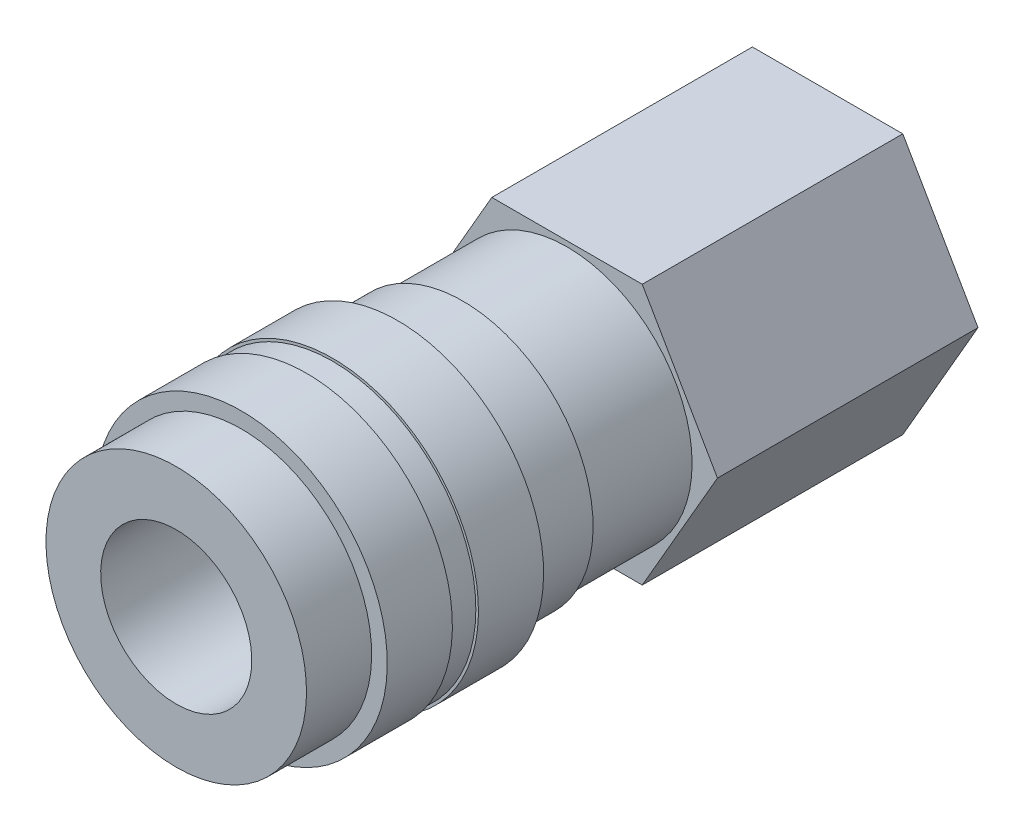
from build123d import *

# Parameters (mm, degrees)
SKETCH2_R                         = 31.732831761
CUT_EXTRUDE1_DEPTH                = 32.254845925
PIPE_TAP_DRILL_FOR_1_8_TAP1_D     = 8.4328
PIPE_TAP_DRILL_FOR_1_8_TAP1_DEPTH = 6.35
PIPE_TAP_DRILL_FOR_1_8_TAP1_TIP   = 2.533468714


with BuildPart() as part:
    # Sketch1 → Revolve1 (revolve)
    with BuildSketch(Plane(origin=(0, 0, 0), x_dir=(0, 0, -1), z_dir=(1, 0, 0)), mode=Mode.PRIVATE) as revolve1_sk:
        Polygon((3.175, 6.35), (3.175, 7.112), (6.35, 7.112), (6.35, 6.985), (7.62, 6.985), (7.62, 7.112), (10.795, 7.112), (10.795, 6.35), (13.97, 6.35), (13.97, 6.096), (19.05, 6.096), (19.05, 17.520886019), (31.75, 17.520886019), (31.75, 0), (12.7, 0), (12.7, 3.683), (0, 3.683), (0, 6.35), align=None)
    revolve(revolve1_sk.sketch.rotate(Axis((0, 0, -12.7), (0, 0, -1)), 180), axis=Axis((0, 0, -12.7), (0, 0, -1)))

    # Sketch2 → Cut-Extrude1 (cut, through all)
    with BuildSketch(Plane(origin=(0, 0, -19.05), x_dir=(-1, 0, 0), z_dir=(0, 0, -1))):
        Circle(SKETCH2_R)
        Polygon((7.332348419, 0), (3.666174209, 6.35), (-3.666174209, 6.35), (-7.332348419, 0), (-3.666174209, -6.35), (3.666174209, -6.35), align=None, mode=Mode.SUBTRACT)
    extrude(amount=CUT_EXTRUDE1_DEPTH, mode=Mode.SUBTRACT)

    # Pipe Tap Drill for 1/8 Tap1
    with Locations(Plane(origin=(0, 0, -31.75), x_dir=(-1, 0, 0), z_dir=(0, 0, -1))):
        with Locations((0, 0)):
            Hole(PIPE_TAP_DRILL_FOR_1_8_TAP1_D / 2, depth=PIPE_TAP_DRILL_FOR_1_8_TAP1_DEPTH)
            with Locations((0, 0, -(PIPE_TAP_DRILL_FOR_1_8_TAP1_DEPTH + PIPE_TAP_DRILL_FOR_1_8_TAP1_TIP / 2))):  # 118° drill point
                Cone(0, PIPE_TAP_DRILL_FOR_1_8_TAP1_D / 2, PIPE_TAP_DRILL_FOR_1_8_TAP1_TIP, mode=Mode.SUBTRACT)


solid = part.part
